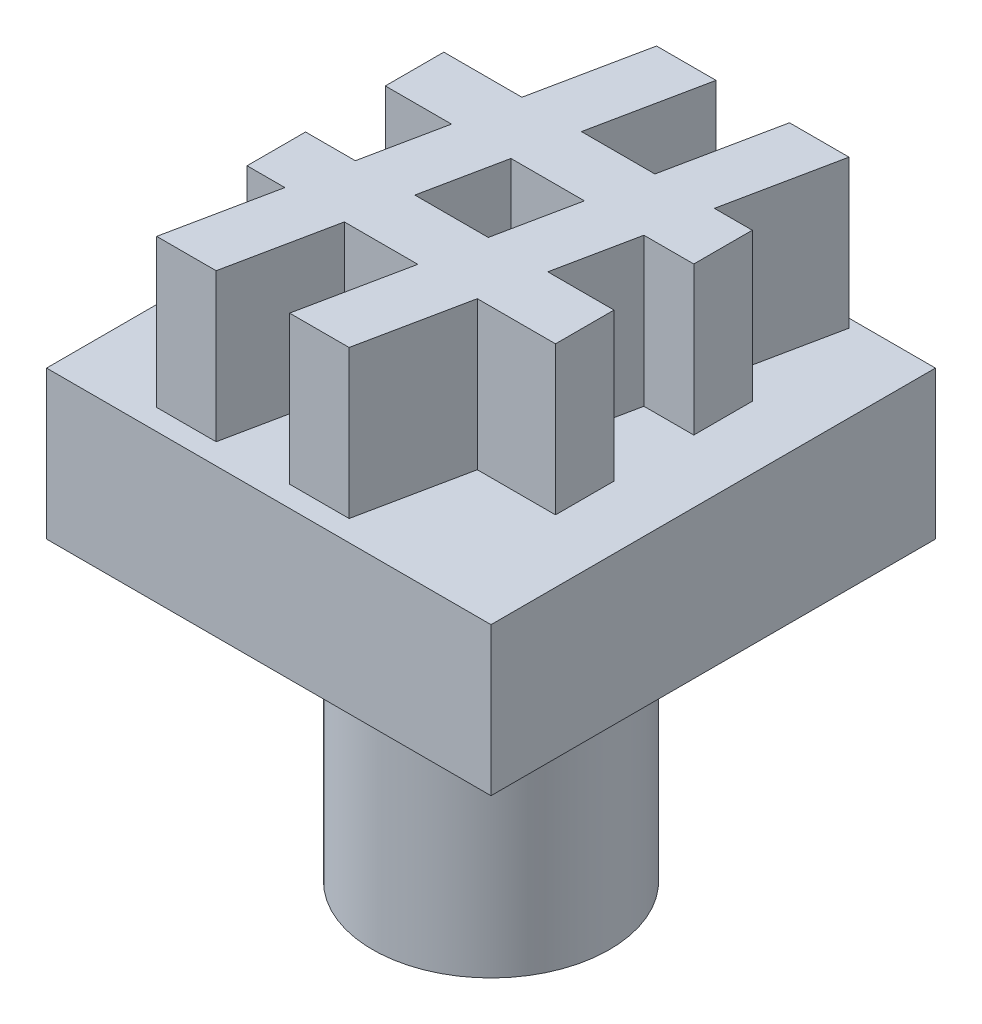
from build123d import *

# Parameters (mm, degrees)
SKETCH1_W           = 15
SKETCH1_H           = 15
BOSS_EXTRUDE1_DEPTH = 5
BOSS_EXTRUDE2_DEPTH = 5
SKETCH3_R           = 4
BOSS_EXTRUDE3_DEPTH = 10


with BuildPart() as part:
    # Sketch1 → Boss-Extrude1 (new body)
    with BuildSketch(Plane(origin=(0, 0, 0), x_dir=(1, 0, 0), z_dir=(0, 1, 0))):
        Rectangle(SKETCH1_W, SKETCH1_H)
    extrude(amount=BOSS_EXTRUDE1_DEPTH)

    # Sketch2 → Boss-Extrude2 (add)
    with BuildSketch(Plane(origin=(0, 5, 0), x_dir=(1, 0, 0), z_dir=(0, 1, 0))):
        Polygon((-3.754056884, -3.202967132), (-5.03009855, -3.202967132), (-5.03009855, -1.228608158), (-3.35021073, -1.228608158), (-2.797726755, 1.463699535), (-5.03009855, 1.463699535), (-5.03009855, 3.438058509), (-2.393880602, 3.438058509), (-1.61984214, 7.207289278), (0.38817068, 7.207289278), (-0.385867781, 3.438058509), (2.093298886, 3.438058509), (2.867337347, 7.207289278), (4.875350168, 7.207289278), (4.101311706, 3.438058509), (5.38015786, 3.438058509), (5.38015786, 1.463699535), (3.697465552, 1.463699535), (3.144981578, -1.228608158), (5.38015786, -1.228608158), (5.38015786, -3.202967132), (2.741135424, -3.202967132), (2.003555296, -6.792710722), (-0.004457525, -6.792710722), (0.733122604, -3.202967132), (-1.746044063, -3.202967132), (-2.483624191, -6.792710722), (-4.491637012, -6.792710722), align=None)
        Polygon((-0.789713935, 1.463699535), (-1.342197909, -1.228608158), (1.136968757, -1.228608158), (1.689452732, 1.463699535), align=None, mode=Mode.SUBTRACT)
    extrude(amount=BOSS_EXTRUDE2_DEPTH)

    # Sketch3 → Boss-Extrude3 (add)
    with BuildSketch(Plane.XZ):
        with Locations(Location((0, 0, 0), (0, 0, 270))):
            Circle(SKETCH3_R)
    extrude(amount=BOSS_EXTRUDE3_DEPTH)


solid = part.part
